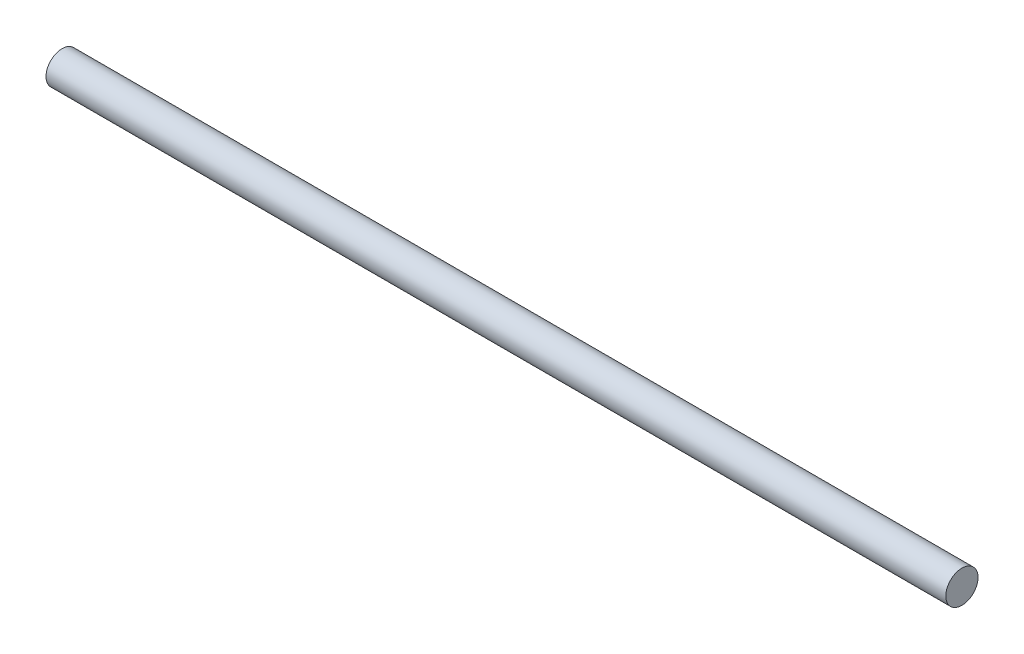
from build123d import *

# Parameters (mm, degrees)
SKETCH1_R           = 5.461
BOSS_EXTRUDE1_DEPTH = 304.8


with BuildPart() as part:
    # Sketch1 → Boss-Extrude1 (new body)
    with BuildSketch(Plane(origin=(0, 0, 0), x_dir=(0, 0, -1), z_dir=(1, 0, 0))):
        with Locations(Location((0, 0, 0), (0, 0, 180))):
            Circle(SKETCH1_R)
    extrude(amount=BOSS_EXTRUDE1_DEPTH)


solid = part.part
